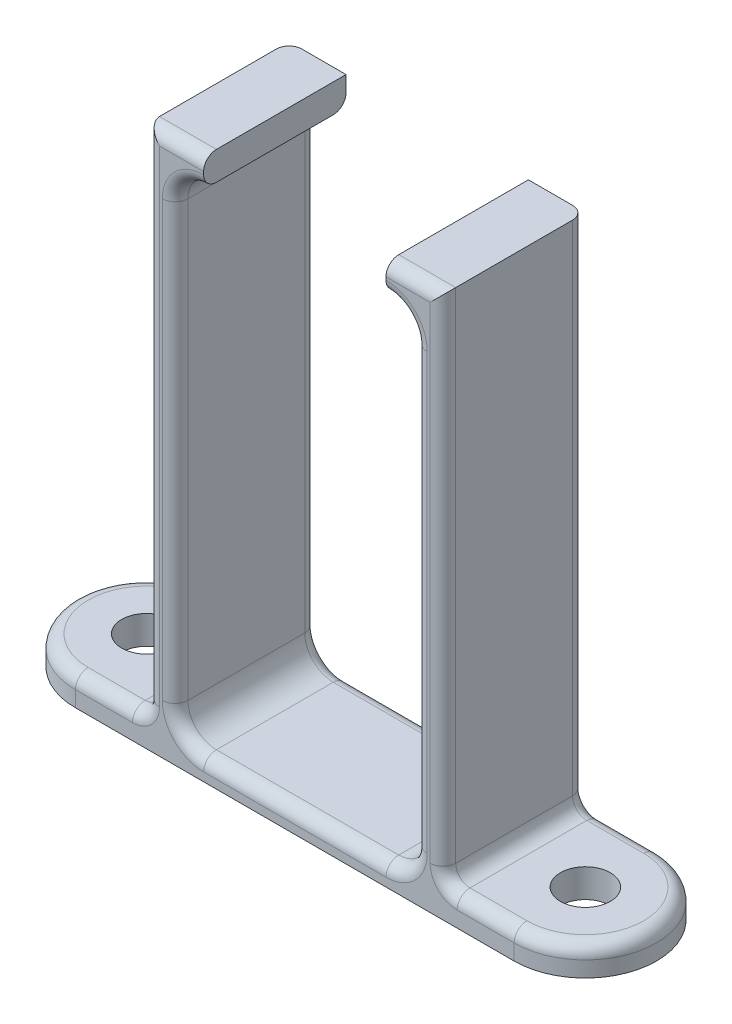
from build123d import *

# Parameters (mm, degrees)
SALIENTE_EXTRUIR1_DEPTH = 10
REDONDEO1_R             = 2
CROQUIS4_R              = 1.75
SALIENTE_EXTRUIR2_DEPTH = 2
REDONDEO3_R             = 1
REDONDEO4_R             = 0.9


with BuildPart() as part:
    # Croquis2 → Saliente-Extruir1 (new body)
    with BuildSketch(Plane.XY):
        with BuildLine():
            Line((-10.4, 0), (10.4, 0))
            Line((10.4, 0), (10.4, 38))
            Line((10.4, 38), (6.4, 38))
            Line((6.4, 38), (6.4, 36))
            ThreePointArc((6.4, 36), (7.814213562, 35.414213562), (8.4, 34))
            Line((8.4, 34), (8.4, 1.5))
            Line((8.4, 1.5), (-8.4, 1.5))
            Line((-8.4, 1.5), (-8.4, 34))
            ThreePointArc((-8.4, 34), (-7.814213562, 35.414213562), (-6.4, 36))
            Line((-6.4, 36), (-6.4, 38))
            Line((-6.4, 38), (-10.4, 38))
            Line((-10.4, 38), (-10.4, 0))
        make_face()
    extrude(amount=SALIENTE_EXTRUIR1_DEPTH)

    # Redondeo1
    redondeo1_edges = [part.edges().sort_by_distance(p)[0] for p in [
        (-8.4, 1.5, 5),
        (8.4, 1.5, 5),
    ]]
    fillet(redondeo1_edges, radius=REDONDEO1_R)

    # Croquis4 → Saliente-Extruir2 (add)
    # profile 1 of 2: a face of its own
    with BuildSketch(Plane.XZ):
        with BuildLine():
            Line((-10.4, 10), (-15.4, 10))
            ThreePointArc((-15.4, 10), (-20.4, 5), (-15.4, 0))
            Line((-15.4, 0), (-10.4, 0))
            Line((-10.4, 0), (-10.4, 10))
        make_face()
        with Locations((-15.4, 5)):
            Circle(CROQUIS4_R, mode=Mode.SUBTRACT)
    # profile 2 of 2: a face of its own
    with BuildSketch(Plane.XZ):
        with BuildLine():
            Line((10.4, 0), (15.4, 0))
            ThreePointArc((15.4, 0), (20.4, 5), (15.4, 10))
            Line((15.4, 10), (10.4, 10))
            Line((10.4, 10), (10.4, 0))
        make_face()
        with Locations(Location((15.4, 5, 0), (0, 0, 180))):
            Circle(CROQUIS4_R, mode=Mode.SUBTRACT)
    extrude(amount=-SALIENTE_EXTRUIR2_DEPTH)

    # Redondeo3
    redondeo3_edges = [part.edges().sort_by_distance(p)[0] for p in [
        (-10.4, 2, 5),
        (10.4, 2, 5),
    ]]
    fillet(redondeo3_edges, radius=REDONDEO3_R)

    # Redondeo4
    redondeo4_edges = [part.edges().sort_by_distance(p)[0] for p in [
        (-10.4, 20.5, 0),
        (-7.814213562, 35.414213562, 0),
        (8.4, 18.75, 0),
        (7.814213562, 35.414213562, 0),
        (7.814213562, 35.414213562, 10),
        (8.4, 18.75, 10),
        (-7.814213562, 35.414213562, 10),
        (0, 1.5, 0),
        (0, 1.5, 10),
        (-8.4, 18.75, 0),
        (-8.4, 18.75, 10),
        (-8.4, 38, 10),
        (7.814213562, 2.085786438, 0),
        (7.814213562, 2.085786438, 10),
        (-7.814213562, 2.085786438, 0),
        (-7.814213562, 2.085786438, 10),
        (-10.4, 20.5, 10),
        (-13.4, 2, 0),
        (-20.4, 2, 5),
        (13.4, 2, 10),
        (20.4, 2, 5),
        (10.4, 20.5, 10),
        (10.4, 20.5, 0),
        (13.4, 2, 0),
        (-13.4, 2, 10),
        (10.692893219, 2.292893219, 0),
        (10.692893219, 2.292893219, 10),
        (-10.692893219, 2.292893219, 10),
        (-10.692893219, 2.292893219, 0),
        (8.4, 38, 10),
    ]]
    fillet(redondeo4_edges, radius=REDONDEO4_R)


solid = part.part
